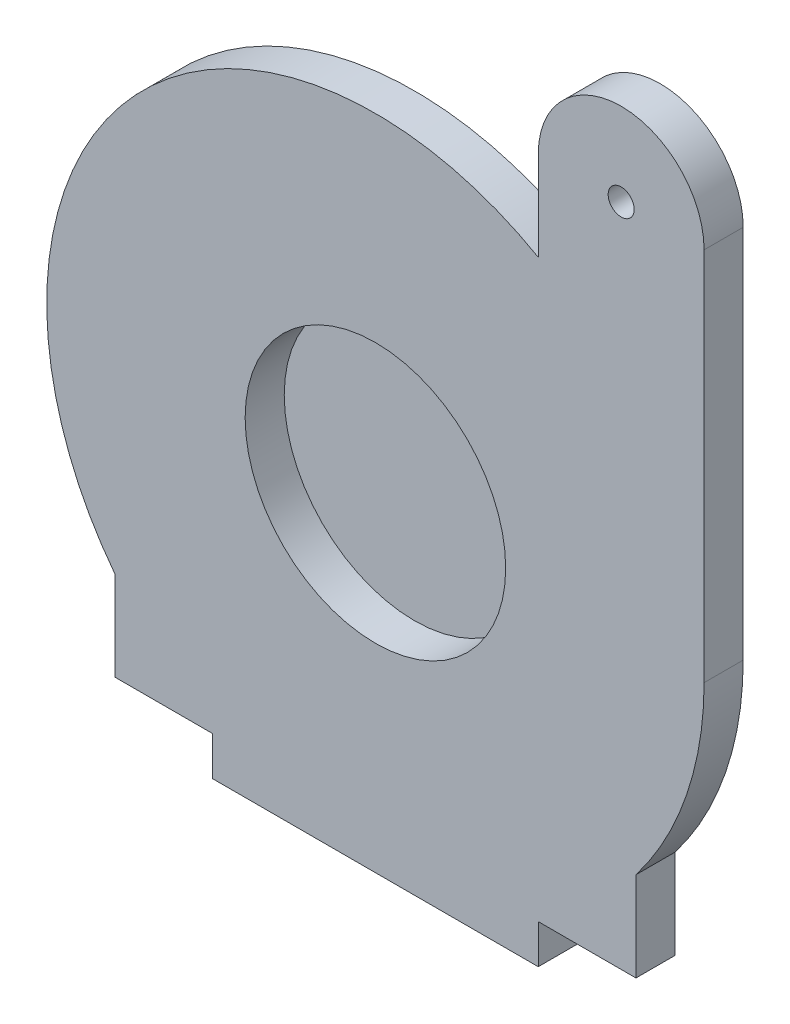
from build123d import *

# Parameters (mm, degrees)
SKETCH1_R           = 17.265633628
SKETCH1_R_2         = 1
SKETCH1_R_3         = 10
SKETCH1_W           = 25
SKETCH1_H           = 3
BOSS_EXTRUDE5_DEPTH = 3
SKETCH2_R           = 17.5
BOSS_EXTRUDE6_DEPTH = 3.5


with BuildPart() as part:
    # Sketch1 → Boss-Extrude5 (new body)
    # profile 1 of 3: a face of its own
    with BuildSketch(Plane.XY):
        with BuildLine():
            Line((0, 0), (7.5, 0))
            Line((7.5, 0), (32.5, 0))
            Line((32.5, 0), (40, 0))
            Line((40, 0), (40, 6.867081787))
            ThreePointArc((40, 6.867081787), (43.887871625, 14.125845764), (45.231531638, 22.249870507))
            Line((45.231531638, 22.249870507), (45.231531638, 51.023857348))
            ThreePointArc((45.231531638, 51.023857348), (38.865765819, 57.389623167), (32.5, 51.023857348))
            Line((32.5, 51.023857348), (32.5, 44.167447672))
            ThreePointArc((32.5, 44.167447672), (0.97654543, 38.82510399), (0, 6.867081787))
            Line((0, 6.867081787), (0, 0))
        make_face()
        with Locations((20, 22.249870507)):
            Circle(SKETCH1_R, mode=Mode.SUBTRACT)
        with Locations((38.865765819, 51.023857348)):
            Circle(SKETCH1_R_2, mode=Mode.SUBTRACT)
    # profile 2 of 3: a face of its own
    with BuildSketch(Plane.XY):
        with Locations((20, 22.249870507)):
            Circle(SKETCH1_R)
        with Locations((20, 22.249870507)):
            Circle(SKETCH1_R_3, mode=Mode.SUBTRACT)
    # profile 3 of 3: a face of its own
    with BuildSketch(Plane.XY):
        with Locations((20, -1.5)):
            Rectangle(SKETCH1_W, SKETCH1_H)
    extrude(amount=BOSS_EXTRUDE5_DEPTH)

    # Sketch2 → Boss-Extrude6 (add)
    with BuildSketch(Plane(origin=(0, 0, 0), x_dir=(-1, 0, 0), z_dir=(0, 0, -1))):
        with Locations(Location((-20, 22.249870507, 0), (0, 0, 180))):
            Circle(SKETCH2_R)
    extrude(amount=BOSS_EXTRUDE6_DEPTH)


solid = part.part
